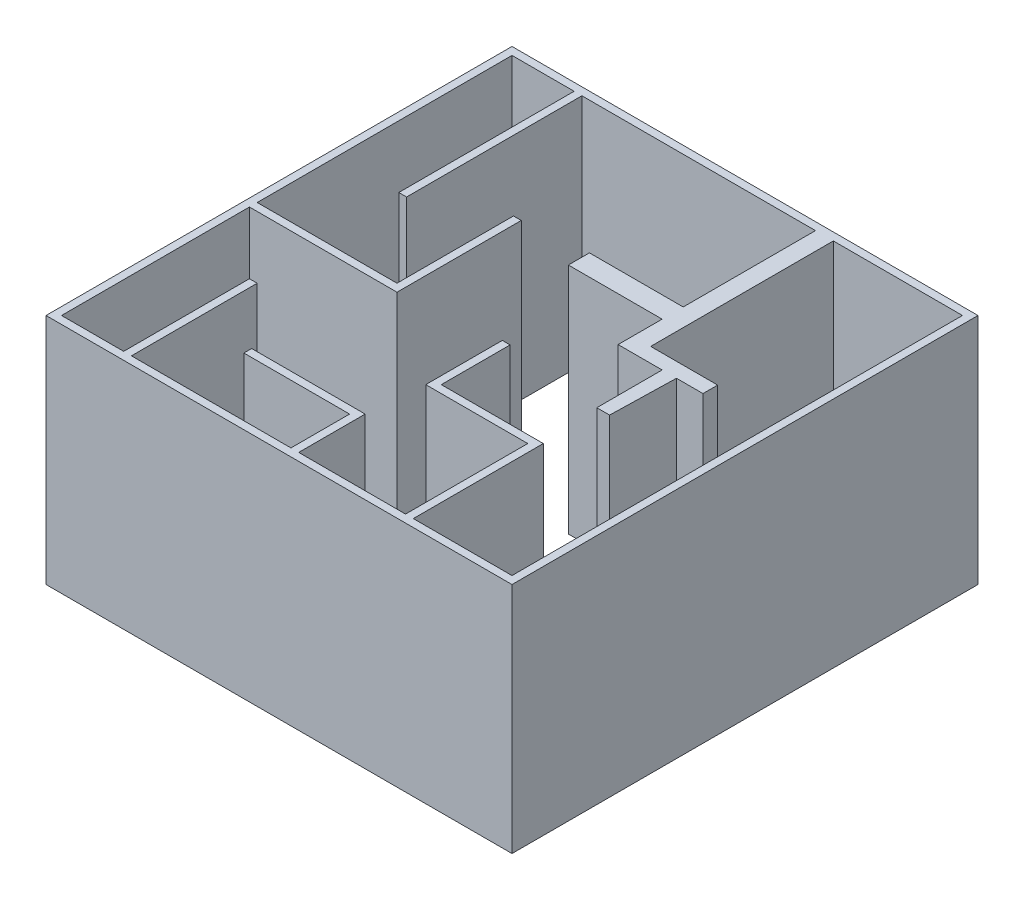
from build123d import *

# Parameters (mm, degrees)
SKETCH1_W           = 30000
SKETCH1_H           = 30000
BOSS_EXTRUDE1_DEPTH = 15000


with BuildPart() as part:
    # Sketch1 → Boss-Extrude1 (new body)
    with BuildSketch(Plane(origin=(0, 0, 0), x_dir=(1, 0, 0), z_dir=(0, 1, 0))):
        with Locations((15000, 15000)):
            Rectangle(SKETCH1_W, SKETCH1_H)
        Polygon((500, 13096.755147093), (9500, 13096.755147093), (9500, 20596.755147093), (10000, 20596.755147093), (10000, 12596.755147093), (500, 12596.755147093), (500, 500), (4500, 500), (4500, 8596.755147093), (5000, 8596.755147093), (5000, 500), (15269.183881246, 500), (15269.183881246, 4276.7457449), (8462.011757956, 4276.7457449), (8462.011757956, 4776.7457449), (15769.183881246, 4776.7457449), (15769.183881246, 500), (22646.603843365, 500), (22646.603843365, 8368.468538599), (16079.401831089, 8368.468538599), (16079.401831089, 13298.67172662), (16579.401831089, 13298.67172662), (16579.401831089, 8868.468538599), (23146.603843365, 8868.468538599), (23146.603843365, 500), (29500, 500), (29500, 29500), (21187.462413517, 29500), (21187.462413517, 17739.27195209), (25500, 17739.27195209), (25500, 16794.697330365), (23794.82814267, 16794.697330365), (23694.036844744, 12587.654768297), (22870.780995046, 12587.654768297), (22870.780995046, 16794.697330365), (20037.063886677, 16794.697330365), (20037.063886677, 19628.42119554), (14000, 19628.42119554), (14000, 20983.680435406), (20037.063886677, 20983.680435406), (20037.063886677, 29500), (5000, 29500), (5000, 18212.454600794), (4500, 18212.454600794), (4500, 29500), (500, 29500), align=None, mode=Mode.SUBTRACT)
    extrude(amount=BOSS_EXTRUDE1_DEPTH)


solid = part.part
